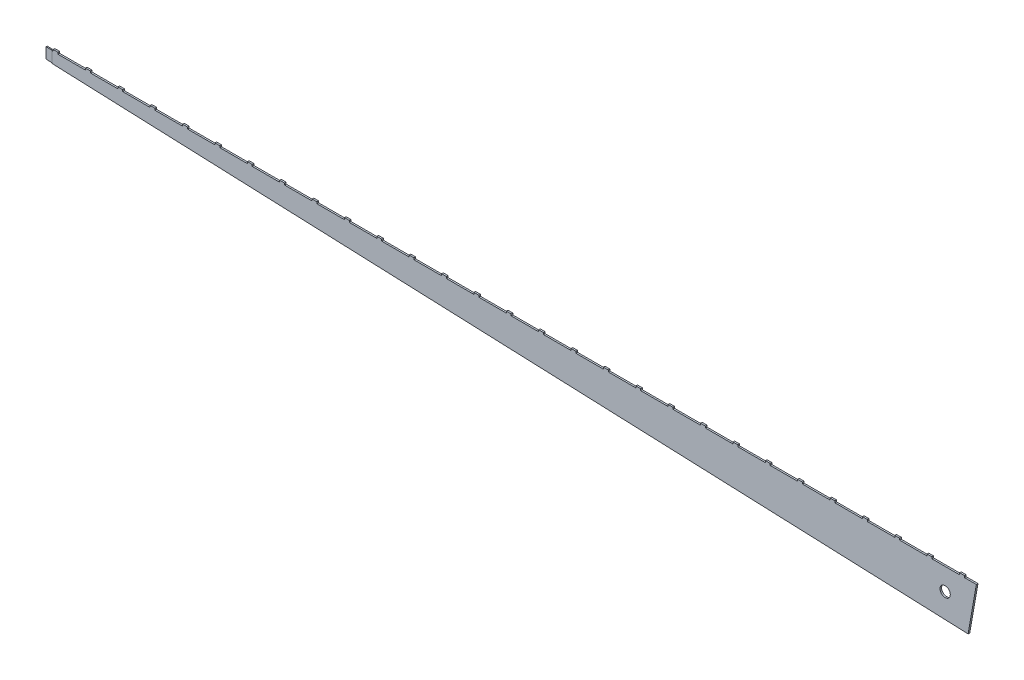
from build123d import *

# Parameters (mm, degrees)
SKETCH1_R                      = 2.4257
EXTRUDE1_DEPTH                 = 0.381
SKETCH2_W                      = 2.286
SKETCH2_H                      = 1.0668
EB_02_TAB_1_DEPTH              = 0.381
LP_01_TAB_1_X_29_X_0_600_COUNT = 29
LP_01_TAB_1_X_29_X_0_600_PITCH = 15.24
SKETCH5_W                      = 6.469789446
SKETCH5_H                      = 8.753244544
EXTRUDE5_DEPTH                 = 0.254


with BuildPart() as part:
    # Sketch1 → Extrude1 (new, symmetric)
    with BuildSketch(Plane.XY):
        Polygon((128.4732, 0), (566.7248, 0), (562.825597202, -22.113477941), (128.4732, -5.047725776), align=None)
        with Locations((552.014887855, -10.287672178)):
            Circle(SKETCH1_R, mode=Mode.SUBTRACT)
    extrude(amount=EXTRUDE1_DEPTH, both=True)

    # Sketch2 → EB-02 Tab 1 (add, symmetric)
    with BuildSketch(Plane.XY):
        with Locations((133.223, 0.2794)):
            Rectangle(SKETCH2_W, SKETCH2_H)
    eb_02_tab_1 = extrude(amount=EB_02_TAB_1_DEPTH, both=True)

    # LP-01 Tab 1 x 29 x 0.600: EB-02 Tab 1 ×29
    with Locations(*[(i * LP_01_TAB_1_X_29_X_0_600_PITCH, 0, 0) for i in range(1, LP_01_TAB_1_X_29_X_0_600_COUNT)]):
        add(eb_02_tab_1)

    # Sketch5 → Extrude5 (cut)
    with BuildSketch(Plane.XY.offset(0.381)):
        with Locations((128.286305277, -2.289052867)):
            Rectangle(SKETCH5_W, SKETCH5_H)
    extrude(amount=-EXTRUDE5_DEPTH, mode=Mode.SUBTRACT)


solid = part.part
